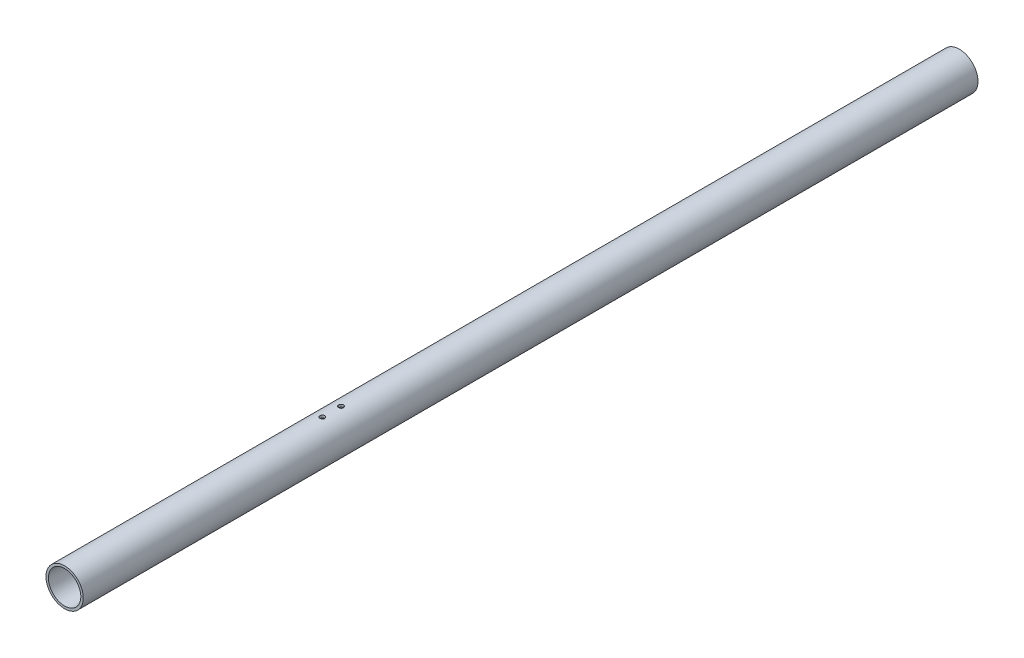
from build123d import *

# Parameters (mm, degrees)
SKETCH1_R           = 12.7
SKETCH1_R_2         = 11.049
BOSS_EXTRUDE1_DEPTH = 609.6
SKETCH2_R           = 11.0998
SKETCH2_R_2         = 11.049
CUT_EXTRUDE1_DEPTH  = 76.2
CUT_EXTRUDE2_REACH  = 612.261
SKETCH5_R           = 1.651
CUT_EXTRUDE3_REACH  = 612.261
SKETCH6_W           = 15.24
SKETCH6_H           = 63.5


with BuildPart() as part:
    # Sketch1 → Boss-Extrude1 (new body)
    with BuildSketch(Plane.XY):
        Circle(SKETCH1_R)
        Circle(SKETCH1_R_2, mode=Mode.SUBTRACT)
    extrude(amount=BOSS_EXTRUDE1_DEPTH)

    # Sketch2 → Cut-Extrude1 (cut)
    with BuildSketch(Plane.XY):
        Circle(SKETCH2_R)
        Circle(SKETCH2_R_2, mode=Mode.SUBTRACT)
    extrude(amount=CUT_EXTRUDE1_DEPTH, mode=Mode.SUBTRACT)

    # Sketch5 → Cut-Extrude2 (cut, up to next)
    with BuildSketch(Plane(origin=(0, 12.7, 0), x_dir=(1, 0, 0), z_dir=(0, 1, 0)), mode=Mode.PRIVATE) as cut_extrude2_sk1:
        with Locations((0, -434.0225)):
            Circle(SKETCH5_R)
    cut_extrude2_tool1 = extrude(cut_extrude2_sk1.sketch, amount=-CUT_EXTRUDE2_REACH, mode=Mode.PRIVATE) & part.part
    # Sketch5 → Cut-Extrude2 (cut, up to next)
    with BuildSketch(Plane(origin=(0, 12.7, 0), x_dir=(1, 0, 0), z_dir=(0, 1, 0)), mode=Mode.PRIVATE) as cut_extrude2_sk2:
        with Locations((0, -421.3225)):
            Circle(SKETCH5_R)
    cut_extrude2_tool2 = extrude(cut_extrude2_sk2.sketch, amount=-CUT_EXTRUDE2_REACH, mode=Mode.PRIVATE) & part.part
    add(cut_extrude2_tool1.solids().sort_by_distance((0, 12.7, 434.0225))[0], mode=Mode.SUBTRACT)
    add(cut_extrude2_tool2.solids().sort_by_distance((0, 12.7, 421.3225))[0], mode=Mode.SUBTRACT)

    # Sketch6 → Cut-Extrude3 (cut, up to next)
    with BuildSketch(Plane(origin=(0, -12.7, 0), x_dir=(-1, 0, 0), z_dir=(0, -1, 0)), mode=Mode.PRIVATE) as cut_extrude3_sk1:
        with Locations((0, -260.35)):
            Rectangle(SKETCH6_W, SKETCH6_H)
    cut_extrude3_tool1 = extrude(cut_extrude3_sk1.sketch, amount=-CUT_EXTRUDE3_REACH, mode=Mode.PRIVATE) & part.part
    add(cut_extrude3_tool1.solids().sort_by_distance((0, -12.7, 260.35))[0], mode=Mode.SUBTRACT)


solid = part.part
